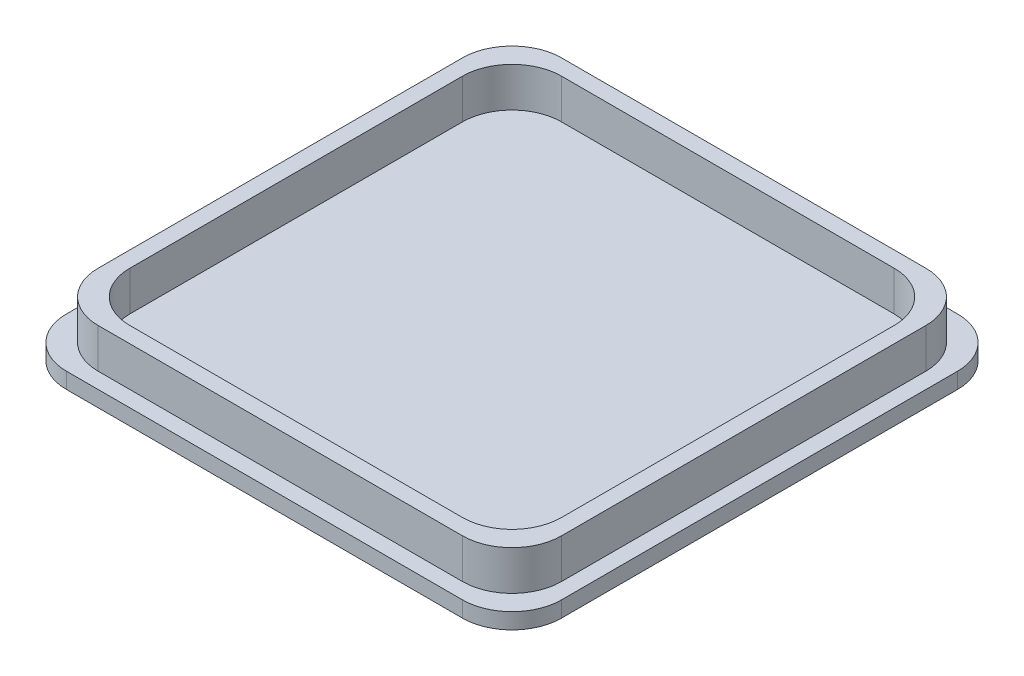
from build123d import *

# Parameters (mm, degrees)
SKETCH1_W           = 50
SKETCH1_H           = 50
BOSS_EXTRUDE1_DEPTH = 1.6
SKETCH2_W           = 46.8
SKETCH2_H           = 46.8
SKETCH2_W_2         = 43.6
SKETCH2_H_2         = 43.6
BOSS_EXTRUDE2_DEPTH = 4
FILLET1_R           = 5


with BuildPart() as part:
    # Sketch1 → Boss-Extrude1 (new body)
    with BuildSketch(Plane(origin=(0, 0, 0), x_dir=(1, 0, 0), z_dir=(0, 1, 0))):
        Rectangle(SKETCH1_W, SKETCH1_H)
    extrude(amount=BOSS_EXTRUDE1_DEPTH)

    # Sketch2 → Boss-Extrude2 (add)
    with BuildSketch(Plane(origin=(0, 1.6, 0), x_dir=(1, 0, 0), z_dir=(0, 1, 0))):
        Rectangle(SKETCH2_W, SKETCH2_H)
        Rectangle(SKETCH2_W_2, SKETCH2_H_2, mode=Mode.SUBTRACT)
    extrude(amount=BOSS_EXTRUDE2_DEPTH)

    # Fillet1
    fillet1_edges = [part.edges().sort_by_distance(p)[0] for p in [
        (-23.4, 3.6, 23.4),
        (23.4, 3.6, 23.4),
        (23.4, 3.6, -23.4),
        (-23.4, 3.6, -23.4),
        (21.8, 3.6, 21.8),
        (21.8, 3.6, -21.8),
        (-21.8, 3.6, -21.8),
        (-21.8, 3.6, 21.8),
        (25, 0.8, 25),
        (-25, 0.8, 25),
        (-25, 0.8, -25),
        (25, 0.8, -25),
    ]]
    fillet(fillet1_edges, radius=FILLET1_R)


solid = part.part
